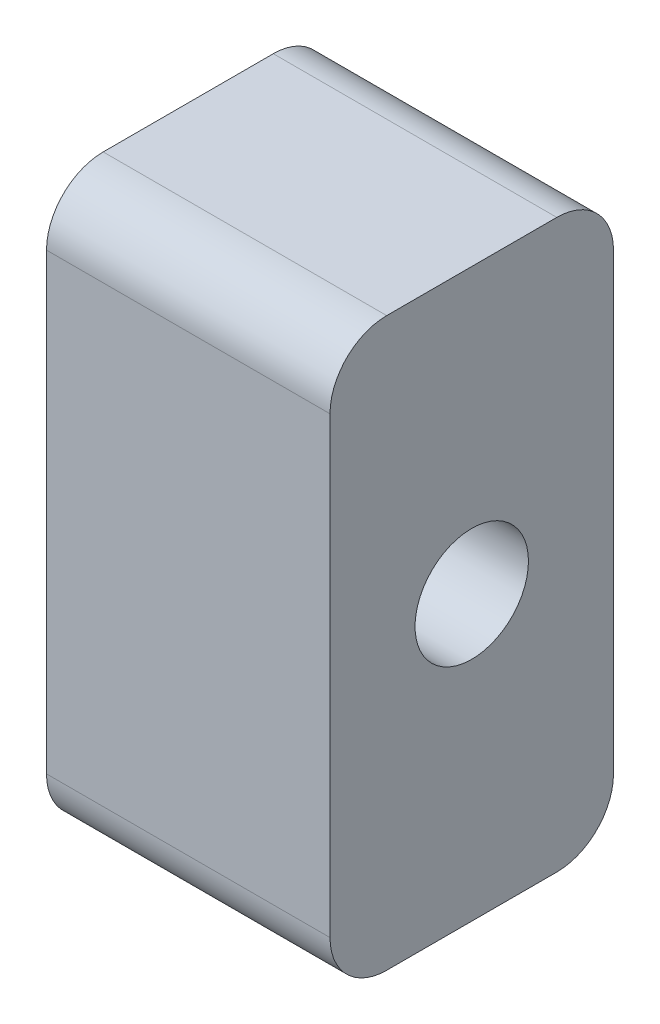
from build123d import *

# Parameters (mm, degrees)
CROQUIS2_R              = 25.4
SALIENTE_EXTRUIR1_DEPTH = 127


with BuildPart() as part:
    # Croquis2 → Saliente-Extruir1 (new body)
    with BuildSketch(Plane.YZ):
        with BuildLine():
            Line((-101.6, 63.5), (101.6, 63.5))
            ThreePointArc((101.6, 63.5), (119.560512242, 56.060512242), (127, 38.1))
            Line((127, 38.1), (127, -38.1))
            ThreePointArc((127, -38.1), (119.560512242, -56.060512242), (101.6, -63.5))
            Line((101.6, -63.5), (-101.6, -63.5))
            ThreePointArc((-101.6, -63.5), (-119.560512242, -56.060512242), (-127, -38.1))
            Line((-127, -38.1), (-127, 38.1))
            ThreePointArc((-127, 38.1), (-119.560512242, 56.060512242), (-101.6, 63.5))
        make_face()
        with Locations(Location((0, 0, 0), (0, 0, 270))):
            Circle(CROQUIS2_R, mode=Mode.SUBTRACT)
    extrude(amount=SALIENTE_EXTRUIR1_DEPTH)


solid = part.part
